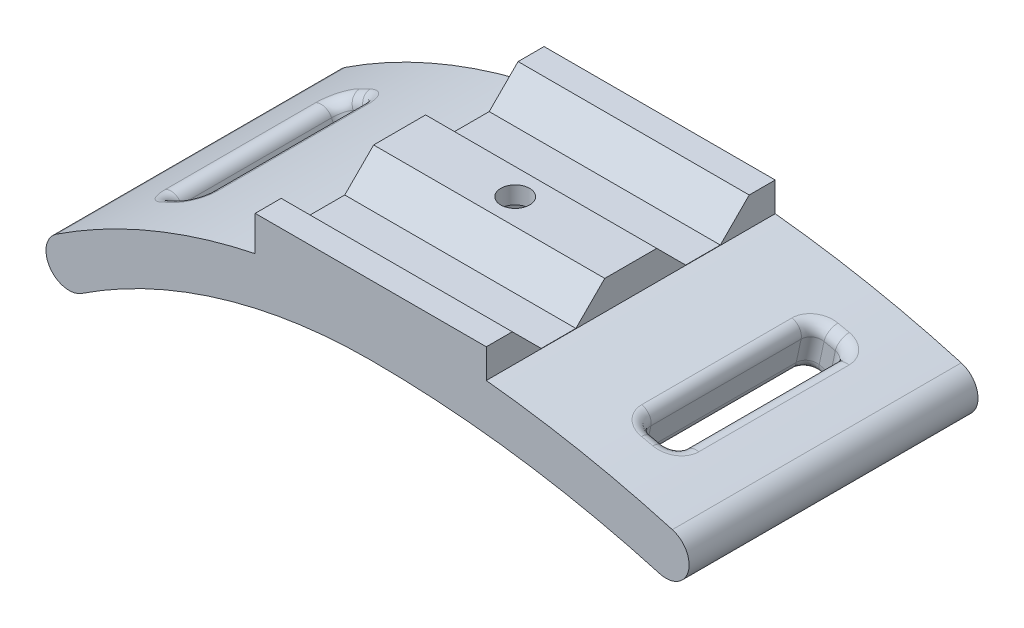
from build123d import *

# Parameters (mm, degrees)
BOSS_EXTRUDE1_DEPTH = 25
SKETCH3_R           = 2.5
CUT_EXTRUDE1_DEPTH  = 50
CUT_EXTRUDE2_START  = -3
CUT_EXTRUDE2_DEPTH  = 65.444438604
CUT_EXTRUDE3_DEPTH  = 84.628823946
CUT_EXTRUDE4_START  = -10
CUT_EXTRUDE4_DEPTH  = 30
FILLET1_R           = 2


with BuildPart() as part:
    # Sketch1 → Boss-Extrude1 (new, symmetric)
    with BuildSketch(Plane.XY):
        with BuildLine():
            Line((-20, 27), (20, 27))
            Line((20, 27), (20, 21.944835171))
            ThreePointArc((20, 21.944835171), (36.233585016, 19.514410323), (52.196939976, 15.692428403))
            ThreePointArc((52.196939976, 15.692428403), (54.94468419, 10.747744213), (50, 8))
            ThreePointArc((50, 8), (25.243811123, 13.241508019), (0, 15))
            ThreePointArc((0, 15), (-26.100766272, 11.169220908), (-50, 0))
            ThreePointArc((-50, 0), (-55.541284404, 1.137614679), (-54.403669725, 6.678899083))
            ThreePointArc((-54.403669725, 6.678899083), (-37.880469758, 15.452469444), (-20, 20.955239224))
            Line((-20, 20.955239224), (-20, 27))
        make_face()
    extrude(amount=BOSS_EXTRUDE1_DEPTH, both=True)

    # Sketch3 → Cut-Extrude1 (cut)
    with BuildSketch(Plane(origin=(0, 27, 0), x_dir=(1, 0, 0), z_dir=(0, 1, 0))):
        with Locations(Location((0, 0, 0), (0, 0, 270))):
            Circle(SKETCH3_R)
    extrude(amount=-CUT_EXTRUDE1_DEPTH, mode=Mode.SUBTRACT)

    # Sketch4 → Cut-Extrude2 (cut, through all)
    with BuildSketch(Plane(origin=(0, 27, 0), x_dir=(1, 0, 0), z_dir=(0, 1, 0)).offset(CUT_EXTRUDE2_START)):
        Polygon((-4.330127019, 0), (-2.165063509, -3.75), (2.165063509, -3.75), (4.330127019, 0), (2.165063509, 3.75), (-2.165063509, 3.75), align=None)
    extrude(amount=-CUT_EXTRUDE2_DEPTH, mode=Mode.SUBTRACT)

    # Sketch5 → Cut-Extrude3 (cut, through all)
    with BuildSketch(Plane.ZY.offset(20)):
        Polygon((20.5, 27), (15.5, 22), (9.5, 22), (4.5, 27), align=None)
    cut_extrude3 = extrude(amount=-CUT_EXTRUDE3_DEPTH, mode=Mode.SUBTRACT)

    # Mirror1: Cut-Extrude3 across plane
    add(cut_extrude3.mirror(Plane.XY), mode=Mode.SUBTRACT)

    # Sketch6 → Cut-Extrude4 (cut)
    with BuildSketch(Plane.XY.offset(25).offset(CUT_EXTRUDE4_START)):
        Polygon((36.914144088, 19.40509522), (42.780809823, 18.147226726), (41.098469988, 10.300837769), (35.231804253, 11.558706263), align=None)
        Polygon((-45.704256205, 11.84875573), (-40.301985021, 14.459400489), (-36.799563679, 7.211754164), (-42.201834862, 4.601109405), align=None)
    extrude(amount=-CUT_EXTRUDE4_DEPTH, mode=Mode.SUBTRACT)

    # Fillet1
    fillet1_edges = [part.edges().sort_by_distance(p)[0] for p in [
        (-43.003120613, 13.15407811, -15),
        (-40.282169492, 14.418395729, 0),
        (-45.684440676, 11.80775097, 0),
        (-43.003120613, 13.15407811, 15),
        (39.847476956, 18.776160973, -15),
        (42.77584611, 18.124076095, 0),
        (36.909180374, 19.38194459, 0),
        (39.847476956, 18.776160973, 15),
        (-42.201834862, 4.601109405, 0),
        (-43.943137769, 8.204430188, 15),
        (-39.522260935, 5.951049865, 15),
        (-38.540866585, 10.815074947, 15),
        (-43.943137769, 8.204430188, -15),
        (-38.540866585, 10.815074947, -15),
        (-39.522260935, 5.951049865, -15),
        (-36.799563679, 7.211754164, 0),
        (35.231804253, 11.558706263, 0),
        (36.070492314, 15.470325427, 15),
        (38.170318963, 10.953939992, 15),
        (41.937158049, 14.212456932, 15),
        (36.070492314, 15.470325427, -15),
        (41.937158049, 14.212456932, -15),
        (38.170318963, 10.953939992, -15),
        (41.098469988, 10.300837769, 0),
    ]]
    fillet(fillet1_edges, radius=FILLET1_R)


solid = part.part
